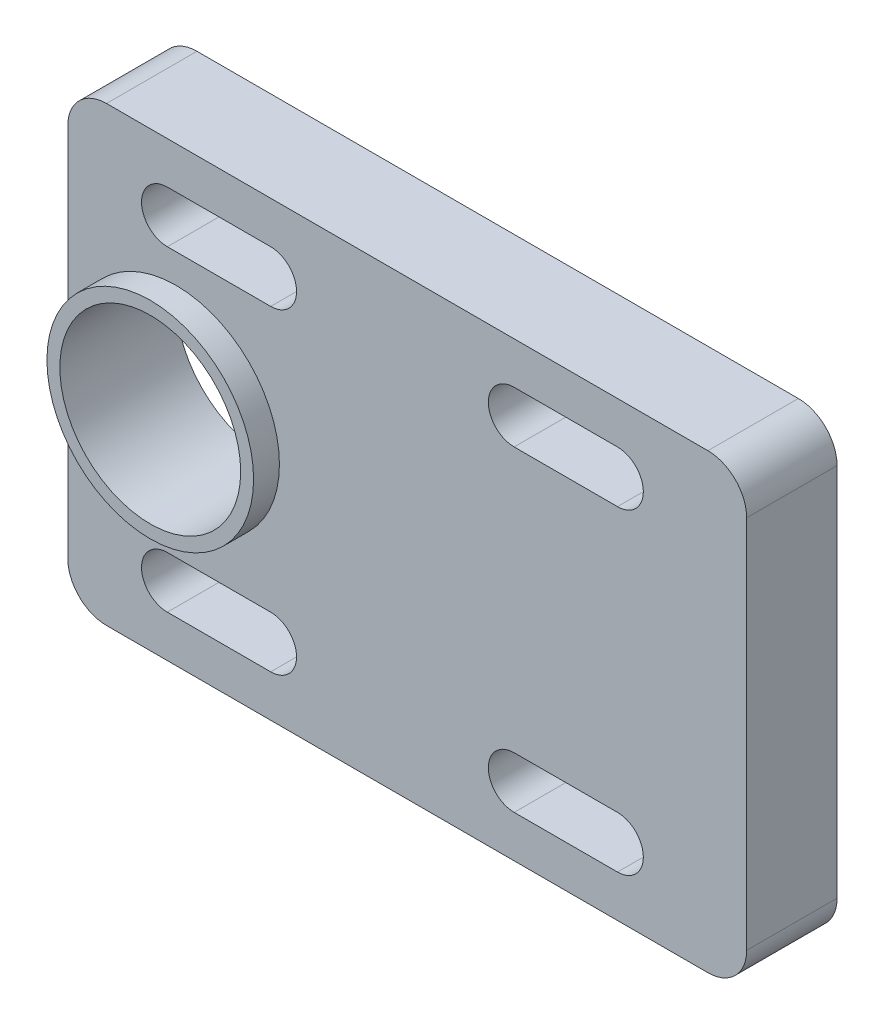
from build123d import *

# Parameters (mm, degrees)
SKETCH1_R           = 7
BOSS_EXTRUDE1_DEPTH = 9
CUT_EXTRUDE1_START  = -2
SKETCH2_R           = 8
CUT_EXTRUDE1_DEPTH  = 2


with BuildPart() as part:
    # Sketch1 → Boss-Extrude1 (new body)
    with BuildSketch(Plane.XY):
        with BuildLine():
            Line((-191.078194945, -17.5), (-144.521304841, -17.5))
            ThreePointArc((-144.521304841, -17.5), (-142.399984498, -16.621320344), (-141.521304841, -14.5))
            Line((-141.521304841, -14.5), (-141.521304841, 14.5))
            ThreePointArc((-141.521304841, 14.5), (-142.399984498, 16.621320344), (-144.521304841, 17.5))
            Line((-144.521304841, 17.5), (-191.078194945, 17.5))
            ThreePointArc((-191.078194945, 17.5), (-193.199515288, 16.621320344), (-194.078194945, 14.5))
            Line((-194.078194945, 14.5), (-194.078194945, -14.5))
            ThreePointArc((-194.078194945, -14.5), (-193.199515288, -16.621320344), (-191.078194945, -17.5))
        make_face()
        with Locations((-185.692771804, 0)):
            Circle(SKETCH1_R, mode=Mode.SUBTRACT)
        with BuildLine():
            Line((-178.368092358, 10.25), (-186.368092358, 10.25))
            ThreePointArc((-186.368092358, 10.25), (-188.368092358, 12.25), (-186.368092358, 14.25))
            Line((-186.368092358, 14.25), (-178.368092358, 14.25))
            ThreePointArc((-178.368092358, 14.25), (-176.368092358, 12.25), (-178.368092358, 10.25))
        make_face(mode=Mode.SUBTRACT)
        with BuildLine():
            Line((-151.521304841, -14.25), (-159.521304841, -14.25))
            ThreePointArc((-159.521304841, -14.25), (-161.521304841, -12.25), (-159.521304841, -10.25))
            Line((-159.521304841, -10.25), (-151.521304841, -10.25))
            ThreePointArc((-151.521304841, -10.25), (-149.521304841, -12.25), (-151.521304841, -14.25))
        make_face(mode=Mode.SUBTRACT)
        with BuildLine():
            Line((-151.521304841, 10.25), (-159.521304841, 10.25))
            ThreePointArc((-159.521304841, 10.25), (-161.521304841, 12.25), (-159.521304841, 14.25))
            Line((-159.521304841, 14.25), (-151.521304841, 14.25))
            ThreePointArc((-151.521304841, 14.25), (-149.521304841, 12.25), (-151.521304841, 10.25))
        make_face(mode=Mode.SUBTRACT)
        with BuildLine():
            Line((-178.368092358, -14.25), (-186.368092358, -14.25))
            ThreePointArc((-186.368092358, -14.25), (-188.368092358, -12.25), (-186.368092358, -10.25))
            Line((-186.368092358, -10.25), (-178.368092358, -10.25))
            ThreePointArc((-178.368092358, -10.25), (-176.368092358, -12.25), (-178.368092358, -14.25))
        make_face(mode=Mode.SUBTRACT)
    extrude(amount=BOSS_EXTRUDE1_DEPTH)

    # Sketch2 → Cut-Extrude1 (cut)
    with BuildSketch(Plane.XY.offset(9).offset(CUT_EXTRUDE1_START)):
        with BuildLine():
            Line((-194.078194945, 14.5), (-194.078194945, -14.5))
            ThreePointArc((-194.078194945, -14.5), (-193.199515288, -16.621320344), (-191.078194945, -17.5))
            Line((-191.078194945, -17.5), (-144.521304841, -17.5))
            ThreePointArc((-144.521304841, -17.5), (-142.399984498, -16.621320344), (-141.521304841, -14.5))
            Line((-141.521304841, -14.5), (-141.521304841, 14.5))
            ThreePointArc((-141.521304841, 14.5), (-142.399984498, 16.621320344), (-144.521304841, 17.5))
            Line((-144.521304841, 17.5), (-191.078194945, 17.5))
            ThreePointArc((-191.078194945, 17.5), (-193.199515288, 16.621320344), (-194.078194945, 14.5))
        make_face()
        with Locations((-185.692771804, 0)):
            Circle(SKETCH2_R, mode=Mode.SUBTRACT)
        with BuildLine():
            ThreePointArc((-186.368092358, -14.25), (-188.368092358, -12.25), (-186.368092358, -10.25))
            Line((-186.368092358, -10.25), (-178.368092358, -10.25))
            ThreePointArc((-178.368092358, -10.25), (-176.368092358, -12.25), (-178.368092358, -14.25))
            Line((-178.368092358, -14.25), (-186.368092358, -14.25))
        make_face(mode=Mode.SUBTRACT)
        with BuildLine():
            Line((-151.521304841, -14.25), (-159.521304841, -14.25))
            ThreePointArc((-159.521304841, -14.25), (-161.521304841, -12.25), (-159.521304841, -10.25))
            Line((-159.521304841, -10.25), (-151.521304841, -10.25))
            ThreePointArc((-151.521304841, -10.25), (-149.521304841, -12.25), (-151.521304841, -14.25))
        make_face(mode=Mode.SUBTRACT)
        with BuildLine():
            ThreePointArc((-159.521304841, 10.25), (-161.521304841, 12.25), (-159.521304841, 14.25))
            Line((-159.521304841, 14.25), (-151.521304841, 14.25))
            ThreePointArc((-151.521304841, 14.25), (-149.521304841, 12.25), (-151.521304841, 10.25))
            Line((-151.521304841, 10.25), (-159.521304841, 10.25))
        make_face(mode=Mode.SUBTRACT)
        with BuildLine():
            Line((-186.368092358, 14.25), (-178.368092358, 14.25))
            ThreePointArc((-178.368092358, 14.25), (-176.368092358, 12.25), (-178.368092358, 10.25))
            Line((-178.368092358, 10.25), (-186.368092358, 10.25))
            ThreePointArc((-186.368092358, 10.25), (-188.368092358, 12.25), (-186.368092358, 14.25))
        make_face(mode=Mode.SUBTRACT)
    extrude(amount=CUT_EXTRUDE1_DEPTH, mode=Mode.SUBTRACT)


solid = part.part
